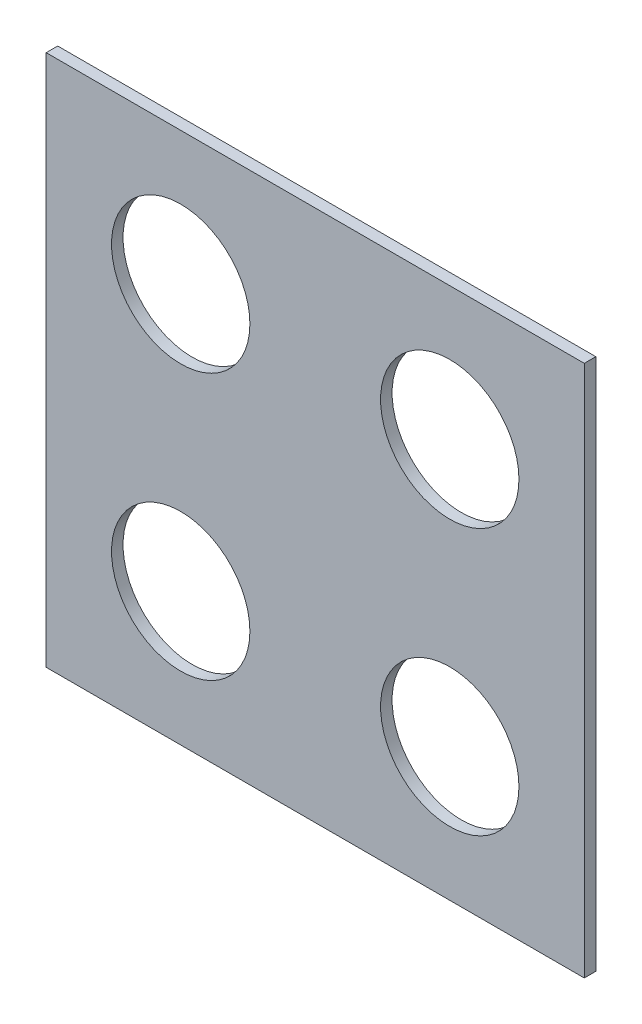
from build123d import *

# Parameters (mm, degrees)
SKETCH1_W           = 280
SKETCH1_H           = 277
BOSS_EXTRUDE1_DEPTH = 6
SKETCH2_R           = 36
CUT_EXTRUDE1_DEPTH  = 198.023475759


with BuildPart() as part:
    # Sketch1 → Boss-Extrude1 (new body)
    with BuildSketch(Plane.XY):
        Rectangle(SKETCH1_W, SKETCH1_H)
    extrude(amount=BOSS_EXTRUDE1_DEPTH)

    # Sketch2 → Cut-Extrude1 (cut, through all)
    with BuildSketch(Plane.XY.offset(6)):
        with Locations((-70, 69.25)):
            Circle(SKETCH2_R)
        with Locations((-70, -69.25)):
            Circle(SKETCH2_R)
        with Locations((70, -69.25)):
            Circle(SKETCH2_R)
        with Locations((70, 69.25)):
            Circle(SKETCH2_R)
    extrude(amount=-CUT_EXTRUDE1_DEPTH, mode=Mode.SUBTRACT)


solid = part.part
